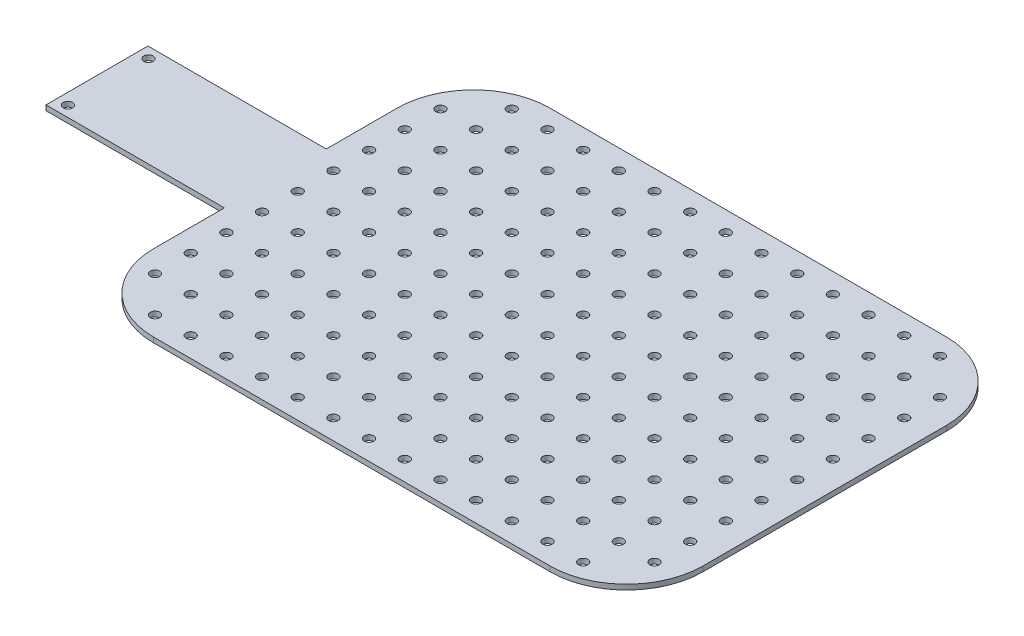
from build123d import *

# Parameters (mm, degrees)
SKETCH1_R           = 1.85
BOSS_EXTRUDE1_DEPTH = 2
SKETCH2_R           = 1.85
CUT_EXTRUDE1_DEPTH  = 2


with BuildPart() as part:
    # Sketch1 → Boss-Extrude1 (new body)
    with BuildSketch(Plane(origin=(0, 0, 0), x_dir=(1, 0, 0), z_dir=(0, 1, 0))):
        with BuildLine():
            Line((77.8, 155.575), (-77.8, 155.575))
            ThreePointArc((-77.8, 155.575), (-99.013203436, 146.788203436), (-107.8, 125.575))
            Line((-107.8, 125.575), (-107.8, 97.7875))
            Line((-107.8, 97.7875), (-177.8, 97.7875))
            Line((-177.8, 97.7875), (-177.8, 57.7875))
            Line((-177.8, 57.7875), (-107.8, 57.7875))
            Line((-107.8, 57.7875), (-107.8, 30))
            ThreePointArc((-107.8, 30), (-99.013203436, 8.786796564), (-77.8, 0))
            Line((-77.8, 0), (77.8, 0))
            ThreePointArc((77.8, 0), (99.013203436, 8.786796564), (107.8, 30))
            Line((107.8, 30), (107.8, 57.7875))
            Line((107.8, 57.7875), (107.8, 97.7875))
            Line((107.8, 97.7875), (107.8, 125.575))
            ThreePointArc((107.8, 125.575), (99.013203436, 146.788203436), (77.8, 155.575))
        make_face()
        with Locations(Location((-173.4, 93.5875, 0), (0, 0, 270))):
            Circle(SKETCH1_R, mode=Mode.SUBTRACT)
        with Locations(Location((-173.4, 61.9875, 0), (0, 0, 270))):
            Circle(SKETCH1_R, mode=Mode.SUBTRACT)
    extrude(amount=BOSS_EXTRUDE1_DEPTH)

    # Sketch2 → Cut-Extrude1 (cut)
    with BuildSketch(Plane(origin=(0, 2, 0), x_dir=(1, 0, 0), z_dir=(0, 1, 0))):
        with Locations(Location((-99.013203436, 21.7875, 0), (0, 0, 270))):
            Circle(SKETCH2_R)
        with Locations(Location((-99.013203436, 35.7875, 0), (0, 0, 270))):
            Circle(SKETCH2_R)
        with Locations(Location((-99.013203436, 49.7875, 0), (0, 0, 270))):
            Circle(SKETCH2_R)
        with Locations(Location((-99.013203436, 63.7875, 0), (0, 0, 270))):
            Circle(SKETCH2_R)
        with Locations(Location((-99.013203436, 77.7875, 0), (0, 0, 270))):
            Circle(SKETCH2_R)
        with Locations(Location((-99.013203436, 91.7875, 0), (0, 0, 270))):
            Circle(SKETCH2_R)
        with Locations(Location((-99.013203436, 105.7875, 0), (0, 0, 270))):
            Circle(SKETCH2_R)
        with Locations(Location((-99.013203436, 119.7875, 0), (0, 0, 270))):
            Circle(SKETCH2_R)
        with Locations(Location((-99.013203436, 133.7875, 0), (0, 0, 270))):
            Circle(SKETCH2_R)
        with Locations(Location((-85.013203436, 63.7875, 0), (0, 0, 270))):
            Circle(SKETCH2_R)
        with Locations(Location((-85.013203436, 49.7875, 0), (0, 0, 270))):
            Circle(SKETCH2_R)
        with Locations(Location((-85.013203436, 35.7875, 0), (0, 0, 270))):
            Circle(SKETCH2_R)
        with Locations(Location((-85.013203436, 21.7875, 0), (0, 0, 270))):
            Circle(SKETCH2_R)
        with Locations(Location((-85.013203436, 91.7875, 0), (0, 0, 270))):
            Circle(SKETCH2_R)
        with Locations(Location((-85.013203436, 105.7875, 0), (0, 0, 270))):
            Circle(SKETCH2_R)
        with Locations(Location((-85.013203436, 77.7875, 0), (0, 0, 270))):
            Circle(SKETCH2_R)
        with Locations(Location((-85.013203436, 133.7875, 0), (0, 0, 270))):
            Circle(SKETCH2_R)
        with Locations(Location((-85.013203436, 119.7875, 0), (0, 0, 270))):
            Circle(SKETCH2_R)
        with Locations(Location((-71.013203436, 63.7875, 0), (0, 0, 270))):
            Circle(SKETCH2_R)
        with Locations(Location((-71.013203436, 49.7875, 0), (0, 0, 270))):
            Circle(SKETCH2_R)
        with Locations(Location((-71.013203436, 35.7875, 0), (0, 0, 270))):
            Circle(SKETCH2_R)
        with Locations(Location((-71.013203436, 21.7875, 0), (0, 0, 270))):
            Circle(SKETCH2_R)
        with Locations(Location((-71.013203436, 91.7875, 0), (0, 0, 270))):
            Circle(SKETCH2_R)
        with Locations(Location((-71.013203436, 105.7875, 0), (0, 0, 270))):
            Circle(SKETCH2_R)
        with Locations(Location((-71.013203436, 77.7875, 0), (0, 0, 270))):
            Circle(SKETCH2_R)
        with Locations(Location((-71.013203436, 133.7875, 0), (0, 0, 270))):
            Circle(SKETCH2_R)
        with Locations(Location((-71.013203436, 119.7875, 0), (0, 0, 270))):
            Circle(SKETCH2_R)
        with Locations(Location((-57.013203436, 63.7875, 0), (0, 0, 270))):
            Circle(SKETCH2_R)
        with Locations(Location((-57.013203436, 49.7875, 0), (0, 0, 270))):
            Circle(SKETCH2_R)
        with Locations(Location((-57.013203436, 35.7875, 0), (0, 0, 270))):
            Circle(SKETCH2_R)
        with Locations(Location((-57.013203436, 21.7875, 0), (0, 0, 270))):
            Circle(SKETCH2_R)
        with Locations(Location((-57.013203436, 91.7875, 0), (0, 0, 270))):
            Circle(SKETCH2_R)
        with Locations(Location((-57.013203436, 105.7875, 0), (0, 0, 270))):
            Circle(SKETCH2_R)
        with Locations(Location((-57.013203436, 77.7875, 0), (0, 0, 270))):
            Circle(SKETCH2_R)
        with Locations(Location((-57.013203436, 133.7875, 0), (0, 0, 270))):
            Circle(SKETCH2_R)
        with Locations(Location((-57.013203436, 119.7875, 0), (0, 0, 270))):
            Circle(SKETCH2_R)
        with Locations(Location((-43.013203436, 63.7875, 0), (0, 0, 270))):
            Circle(SKETCH2_R)
        with Locations(Location((-43.013203436, 49.7875, 0), (0, 0, 270))):
            Circle(SKETCH2_R)
        with Locations(Location((-43.013203436, 35.7875, 0), (0, 0, 270))):
            Circle(SKETCH2_R)
        with Locations(Location((-43.013203436, 21.7875, 0), (0, 0, 270))):
            Circle(SKETCH2_R)
        with Locations(Location((-43.013203436, 91.7875, 0), (0, 0, 270))):
            Circle(SKETCH2_R)
        with Locations(Location((-43.013203436, 105.7875, 0), (0, 0, 270))):
            Circle(SKETCH2_R)
        with Locations(Location((-43.013203436, 77.7875, 0), (0, 0, 270))):
            Circle(SKETCH2_R)
        with Locations(Location((-43.013203436, 133.7875, 0), (0, 0, 270))):
            Circle(SKETCH2_R)
        with Locations(Location((-43.013203436, 119.7875, 0), (0, 0, 270))):
            Circle(SKETCH2_R)
        with Locations(Location((-29.013203436, 63.7875, 0), (0, 0, 270))):
            Circle(SKETCH2_R)
        with Locations(Location((-29.013203436, 49.7875, 0), (0, 0, 270))):
            Circle(SKETCH2_R)
        with Locations(Location((-29.013203436, 35.7875, 0), (0, 0, 270))):
            Circle(SKETCH2_R)
        with Locations(Location((-29.013203436, 21.7875, 0), (0, 0, 270))):
            Circle(SKETCH2_R)
        with Locations(Location((-29.013203436, 91.7875, 0), (0, 0, 270))):
            Circle(SKETCH2_R)
        with Locations(Location((-29.013203436, 105.7875, 0), (0, 0, 270))):
            Circle(SKETCH2_R)
        with Locations(Location((-29.013203436, 77.7875, 0), (0, 0, 270))):
            Circle(SKETCH2_R)
        with Locations(Location((-29.013203436, 133.7875, 0), (0, 0, 270))):
            Circle(SKETCH2_R)
        with Locations(Location((-29.013203436, 119.7875, 0), (0, 0, 270))):
            Circle(SKETCH2_R)
        with Locations(Location((-15.013203436, 63.7875, 0), (0, 0, 270))):
            Circle(SKETCH2_R)
        with Locations(Location((-15.013203436, 49.7875, 0), (0, 0, 270))):
            Circle(SKETCH2_R)
        with Locations(Location((-15.013203436, 35.7875, 0), (0, 0, 270))):
            Circle(SKETCH2_R)
        with Locations(Location((-15.013203436, 21.7875, 0), (0, 0, 270))):
            Circle(SKETCH2_R)
        with Locations(Location((-15.013203436, 91.7875, 0), (0, 0, 270))):
            Circle(SKETCH2_R)
        with Locations(Location((-15.013203436, 105.7875, 0), (0, 0, 270))):
            Circle(SKETCH2_R)
        with Locations(Location((-15.013203436, 77.7875, 0), (0, 0, 270))):
            Circle(SKETCH2_R)
        with Locations(Location((-15.013203436, 133.7875, 0), (0, 0, 270))):
            Circle(SKETCH2_R)
        with Locations(Location((-15.013203436, 119.7875, 0), (0, 0, 270))):
            Circle(SKETCH2_R)
        with Locations(Location((-1.013203436, 63.7875, 0), (0, 0, 270))):
            Circle(SKETCH2_R)
        with Locations(Location((-1.013203436, 49.7875, 0), (0, 0, 270))):
            Circle(SKETCH2_R)
        with Locations(Location((-1.013203436, 35.7875, 0), (0, 0, 270))):
            Circle(SKETCH2_R)
        with Locations(Location((-1.013203436, 21.7875, 0), (0, 0, 270))):
            Circle(SKETCH2_R)
        with Locations(Location((-1.013203436, 91.7875, 0), (0, 0, 270))):
            Circle(SKETCH2_R)
        with Locations(Location((-1.013203436, 105.7875, 0), (0, 0, 270))):
            Circle(SKETCH2_R)
        with Locations(Location((-1.013203436, 77.7875, 0), (0, 0, 270))):
            Circle(SKETCH2_R)
        with Locations(Location((-1.013203436, 133.7875, 0), (0, 0, 270))):
            Circle(SKETCH2_R)
        with Locations(Location((-1.013203436, 119.7875, 0), (0, 0, 270))):
            Circle(SKETCH2_R)
        with Locations(Location((12.986796564, 63.7875, 0), (0, 0, 270))):
            Circle(SKETCH2_R)
        with Locations(Location((12.986796564, 49.7875, 0), (0, 0, 270))):
            Circle(SKETCH2_R)
        with Locations(Location((12.986796564, 35.7875, 0), (0, 0, 270))):
            Circle(SKETCH2_R)
        with Locations(Location((12.986796564, 21.7875, 0), (0, 0, 270))):
            Circle(SKETCH2_R)
        with Locations(Location((12.986796564, 91.7875, 0), (0, 0, 270))):
            Circle(SKETCH2_R)
        with Locations(Location((12.986796564, 105.7875, 0), (0, 0, 270))):
            Circle(SKETCH2_R)
        with Locations(Location((12.986796564, 77.7875, 0), (0, 0, 270))):
            Circle(SKETCH2_R)
        with Locations(Location((12.986796564, 133.7875, 0), (0, 0, 270))):
            Circle(SKETCH2_R)
        with Locations(Location((12.986796564, 119.7875, 0), (0, 0, 270))):
            Circle(SKETCH2_R)
        with Locations(Location((26.986796564, 63.7875, 0), (0, 0, 270))):
            Circle(SKETCH2_R)
        with Locations(Location((26.986796564, 49.7875, 0), (0, 0, 270))):
            Circle(SKETCH2_R)
        with Locations(Location((26.986796564, 35.7875, 0), (0, 0, 270))):
            Circle(SKETCH2_R)
        with Locations(Location((26.986796564, 21.7875, 0), (0, 0, 270))):
            Circle(SKETCH2_R)
        with Locations(Location((26.986796564, 91.7875, 0), (0, 0, 270))):
            Circle(SKETCH2_R)
        with Locations(Location((26.986796564, 105.7875, 0), (0, 0, 270))):
            Circle(SKETCH2_R)
        with Locations(Location((26.986796564, 77.7875, 0), (0, 0, 270))):
            Circle(SKETCH2_R)
        with Locations(Location((26.986796564, 133.7875, 0), (0, 0, 270))):
            Circle(SKETCH2_R)
        with Locations(Location((26.986796564, 119.7875, 0), (0, 0, 270))):
            Circle(SKETCH2_R)
        with Locations(Location((40.986796564, 63.7875, 0), (0, 0, 270))):
            Circle(SKETCH2_R)
        with Locations(Location((40.986796564, 49.7875, 0), (0, 0, 270))):
            Circle(SKETCH2_R)
        with Locations(Location((40.986796564, 35.7875, 0), (0, 0, 270))):
            Circle(SKETCH2_R)
        with Locations(Location((40.986796564, 21.7875, 0), (0, 0, 270))):
            Circle(SKETCH2_R)
        with Locations(Location((40.986796564, 91.7875, 0), (0, 0, 270))):
            Circle(SKETCH2_R)
        with Locations(Location((40.986796564, 105.7875, 0), (0, 0, 270))):
            Circle(SKETCH2_R)
        with Locations(Location((40.986796564, 77.7875, 0), (0, 0, 270))):
            Circle(SKETCH2_R)
        with Locations(Location((40.986796564, 133.7875, 0), (0, 0, 270))):
            Circle(SKETCH2_R)
        with Locations(Location((40.986796564, 119.7875, 0), (0, 0, 270))):
            Circle(SKETCH2_R)
        with Locations(Location((54.986796564, 63.7875, 0), (0, 0, 270))):
            Circle(SKETCH2_R)
        with Locations(Location((54.986796564, 49.7875, 0), (0, 0, 270))):
            Circle(SKETCH2_R)
        with Locations(Location((54.986796564, 35.7875, 0), (0, 0, 270))):
            Circle(SKETCH2_R)
        with Locations(Location((54.986796564, 21.7875, 0), (0, 0, 270))):
            Circle(SKETCH2_R)
        with Locations(Location((54.986796564, 91.7875, 0), (0, 0, 270))):
            Circle(SKETCH2_R)
        with Locations(Location((54.986796564, 105.7875, 0), (0, 0, 270))):
            Circle(SKETCH2_R)
        with Locations(Location((54.986796564, 77.7875, 0), (0, 0, 270))):
            Circle(SKETCH2_R)
        with Locations(Location((54.986796564, 133.7875, 0), (0, 0, 270))):
            Circle(SKETCH2_R)
        with Locations(Location((54.986796564, 119.7875, 0), (0, 0, 270))):
            Circle(SKETCH2_R)
        with Locations(Location((68.986796564, 63.7875, 0), (0, 0, 270))):
            Circle(SKETCH2_R)
        with Locations(Location((68.986796564, 49.7875, 0), (0, 0, 270))):
            Circle(SKETCH2_R)
        with Locations(Location((68.986796564, 35.7875, 0), (0, 0, 270))):
            Circle(SKETCH2_R)
        with Locations(Location((68.986796564, 21.7875, 0), (0, 0, 270))):
            Circle(SKETCH2_R)
        with Locations(Location((68.986796564, 91.7875, 0), (0, 0, 270))):
            Circle(SKETCH2_R)
        with Locations(Location((68.986796564, 105.7875, 0), (0, 0, 270))):
            Circle(SKETCH2_R)
        with Locations(Location((68.986796564, 77.7875, 0), (0, 0, 270))):
            Circle(SKETCH2_R)
        with Locations(Location((68.986796564, 133.7875, 0), (0, 0, 270))):
            Circle(SKETCH2_R)
        with Locations(Location((68.986796564, 119.7875, 0), (0, 0, 270))):
            Circle(SKETCH2_R)
        with Locations(Location((82.986796564, 63.7875, 0), (0, 0, 270))):
            Circle(SKETCH2_R)
        with Locations(Location((82.986796564, 49.7875, 0), (0, 0, 270))):
            Circle(SKETCH2_R)
        with Locations(Location((82.986796564, 35.7875, 0), (0, 0, 270))):
            Circle(SKETCH2_R)
        with Locations(Location((82.986796564, 21.7875, 0), (0, 0, 270))):
            Circle(SKETCH2_R)
        with Locations(Location((82.986796564, 91.7875, 0), (0, 0, 270))):
            Circle(SKETCH2_R)
        with Locations(Location((82.986796564, 105.7875, 0), (0, 0, 270))):
            Circle(SKETCH2_R)
        with Locations(Location((82.986796564, 77.7875, 0), (0, 0, 270))):
            Circle(SKETCH2_R)
        with Locations(Location((82.986796564, 133.7875, 0), (0, 0, 270))):
            Circle(SKETCH2_R)
        with Locations(Location((82.986796564, 119.7875, 0), (0, 0, 270))):
            Circle(SKETCH2_R)
        with Locations(Location((96.986796564, 63.7875, 0), (0, 0, 270))):
            Circle(SKETCH2_R)
        with Locations(Location((96.986796564, 49.7875, 0), (0, 0, 270))):
            Circle(SKETCH2_R)
        with Locations(Location((96.986796564, 35.7875, 0), (0, 0, 270))):
            Circle(SKETCH2_R)
        with Locations(Location((96.986796564, 21.7875, 0), (0, 0, 270))):
            Circle(SKETCH2_R)
        with Locations(Location((96.986796564, 91.7875, 0), (0, 0, 270))):
            Circle(SKETCH2_R)
        with Locations(Location((96.986796564, 105.7875, 0), (0, 0, 270))):
            Circle(SKETCH2_R)
        with Locations(Location((96.986796564, 77.7875, 0), (0, 0, 270))):
            Circle(SKETCH2_R)
        with Locations(Location((96.986796564, 133.7875, 0), (0, 0, 270))):
            Circle(SKETCH2_R)
        with Locations(Location((96.986796564, 119.7875, 0), (0, 0, 270))):
            Circle(SKETCH2_R)
        with Locations(Location((-85.013203436, 147.7875, 0), (0, 0, 270))):
            Circle(SKETCH2_R)
        with Locations(Location((-1.013203436, 147.7875, 0), (0, 0, 270))):
            Circle(SKETCH2_R)
        with Locations(Location((-15.013203436, 147.7875, 0), (0, 0, 270))):
            Circle(SKETCH2_R)
        with Locations(Location((-29.013203436, 147.7875, 0), (0, 0, 270))):
            Circle(SKETCH2_R)
        with Locations(Location((-43.013203436, 147.7875, 0), (0, 0, 270))):
            Circle(SKETCH2_R)
        with Locations(Location((-57.013203436, 147.7875, 0), (0, 0, 270))):
            Circle(SKETCH2_R)
        with Locations(Location((-71.013203436, 147.7875, 0), (0, 0, 270))):
            Circle(SKETCH2_R)
        with Locations(Location((12.986796564, 147.7875, 0), (0, 0, 270))):
            Circle(SKETCH2_R)
        with Locations(Location((26.986796564, 147.7875, 0), (0, 0, 270))):
            Circle(SKETCH2_R)
        with Locations(Location((82.986796564, 147.7875, 0), (0, 0, 270))):
            Circle(SKETCH2_R)
        with Locations(Location((68.986796564, 147.7875, 0), (0, 0, 270))):
            Circle(SKETCH2_R)
        with Locations(Location((54.986796564, 147.7875, 0), (0, 0, 270))):
            Circle(SKETCH2_R)
        with Locations(Location((40.986796564, 147.7875, 0), (0, 0, 270))):
            Circle(SKETCH2_R)
        with Locations(Location((-85.013203436, 7.7875, 0), (0, 0, 270))):
            Circle(SKETCH2_R)
        with Locations(Location((-71.013203436, 7.7875, 0), (0, 0, 270))):
            Circle(SKETCH2_R)
        with Locations(Location((-57.013203436, 7.7875, 0), (0, 0, 270))):
            Circle(SKETCH2_R)
        with Locations(Location((-43.013203436, 7.7875, 0), (0, 0, 270))):
            Circle(SKETCH2_R)
        with Locations(Location((-29.013203436, 7.7875, 0), (0, 0, 270))):
            Circle(SKETCH2_R)
        with Locations(Location((-15.013203436, 7.7875, 0), (0, 0, 270))):
            Circle(SKETCH2_R)
        with Locations(Location((-1.013203436, 7.7875, 0), (0, 0, 270))):
            Circle(SKETCH2_R)
        with Locations(Location((12.986796564, 7.7875, 0), (0, 0, 270))):
            Circle(SKETCH2_R)
        with Locations(Location((26.986796564, 7.7875, 0), (0, 0, 270))):
            Circle(SKETCH2_R)
        with Locations(Location((40.986796564, 7.7875, 0), (0, 0, 270))):
            Circle(SKETCH2_R)
        with Locations(Location((54.986796564, 7.7875, 0), (0, 0, 270))):
            Circle(SKETCH2_R)
        with Locations(Location((68.986796564, 7.7875, 0), (0, 0, 270))):
            Circle(SKETCH2_R)
        with Locations(Location((82.986796564, 7.7875, 0), (0, 0, 270))):
            Circle(SKETCH2_R)
    extrude(amount=-CUT_EXTRUDE1_DEPTH, mode=Mode.SUBTRACT)


solid = part.part
